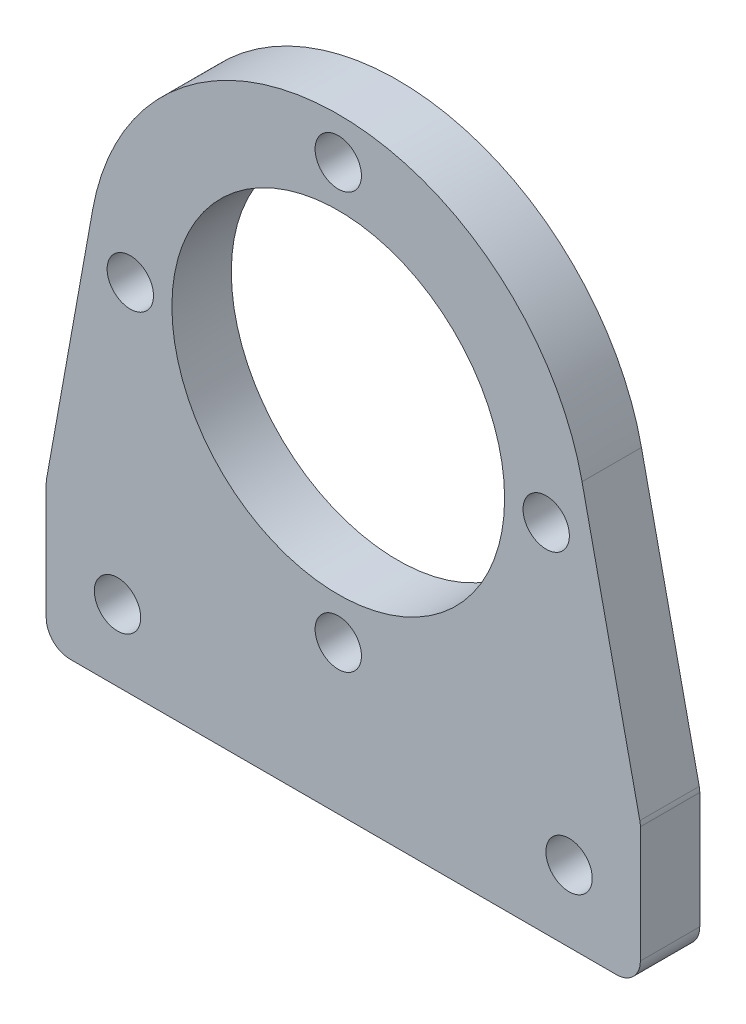
from build123d import *

# Parameters (mm, degrees)
SKETCH_1_R          = 1.95
SKETCH_1_R_2        = 14
EXTRUDE_1_DEPTH     = 5
SKETCH_2_R          = 1.95
CUT_EXTRUDE_1_DEPTH = 40.6408375
FILLET_1_R          = 2


with BuildPart() as part:
    # 草图1 → 凸台-拉伸1 (new body)
    with BuildSketch(Plane.XY):
        with BuildLine():
            Line((-20.668149566, 3.718547232), (-24.575680979, -18))
            Line((-24.575680979, -18), (-24.575680979, -30))
            Line((-24.575680979, -30), (25.424319021, -30))
            Line((25.424319021, -30), (25.424319021, -18))
            Line((25.424319021, -18), (20.516756247, 4.479142005))
            ThreePointArc((20.516756247, 4.479142005), (-0.387757768, 20.996419788), (-20.668149566, 3.718547232))
        make_face()
        with Locations((0, 17.5)):
            Circle(SKETCH_1_R, mode=Mode.SUBTRACT)
        with Locations((17.5, 0)):
            Circle(SKETCH_1_R, mode=Mode.SUBTRACT)
        with Locations((0, -17.5)):
            Circle(SKETCH_1_R, mode=Mode.SUBTRACT)
        with Locations((-17.5, 0)):
            Circle(SKETCH_1_R, mode=Mode.SUBTRACT)
        Circle(SKETCH_1_R_2, mode=Mode.SUBTRACT)
    extrude(amount=EXTRUDE_1_DEPTH)

    # 草图2 → 切除-拉伸1 (cut, through all)
    with BuildSketch(Plane.XY.offset(5)):
        with Locations((19.424319021, -24)):
            Circle(SKETCH_2_R)
        with Locations((-18.575680979, -24)):
            Circle(SKETCH_2_R)
    extrude(amount=-CUT_EXTRUDE_1_DEPTH, mode=Mode.SUBTRACT)

    # 圆角1
    fillet_1_edges = [part.edges().sort_by_distance(p)[0] for p in [
        (25.424319021, -18, 2.5),
        (25.424319021, -30, 2.5),
        (-24.575680979, -30, 2.5),
        (-24.575680979, -18, 2.5),
    ]]
    fillet(fillet_1_edges, radius=FILLET_1_R)


solid = part.part
